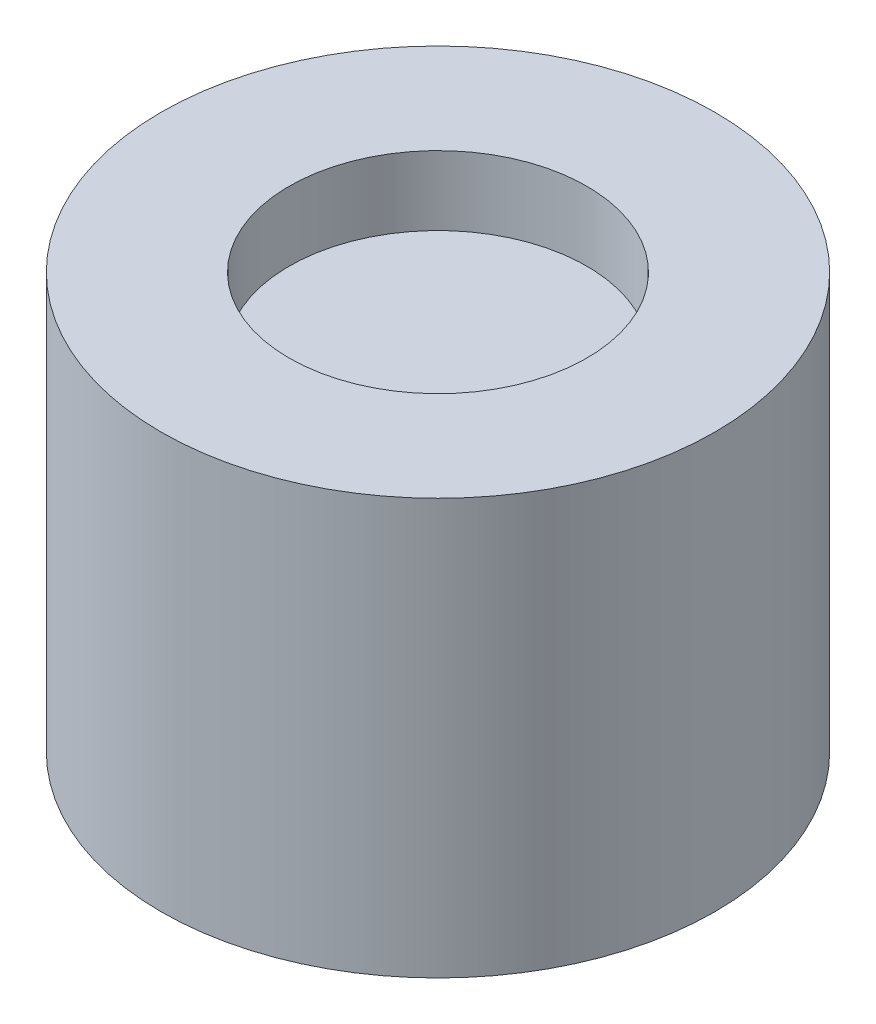
from build123d import *

# Parameters (mm, degrees)
SKETCH1_R        = 4
SKETCH1_R_2      = 1.26
EXTRUSION1_DEPTH = 4
SKETCH2_R        = 4
EXTRUSION2_DEPTH = 1
SKETCH3_R        = 4
SKETCH3_R_2      = 2.15
EXTRUSION3_DEPTH = 1


with BuildPart() as part:
    # Sketch1 → Extrusion1 (new body)
    with BuildSketch(Plane(origin=(0, 0, 0), x_dir=(-1, 0, 0), z_dir=(0, 1, 0))):
        with Locations(Location((0, 0, 0), (0, 0, 90))):
            Circle(SKETCH1_R)
        with Locations(Location((0, 0, 0), (0, 0, 90))):
            Circle(SKETCH1_R_2, mode=Mode.SUBTRACT)
    extrude(amount=EXTRUSION1_DEPTH)

    # Sketch2 → Extrusion2 (add)
    with BuildSketch(Plane(origin=(0, 4, 0), x_dir=(1, 0, 0), z_dir=(0, 1, 0))):
        with Locations(Location((0, 0, 0), (0, 0, 270))):
            Circle(SKETCH2_R)
    extrude(amount=EXTRUSION2_DEPTH)

    # Sketch3 → Extrusion3 (add)
    with BuildSketch(Plane(origin=(0, 5, 0), x_dir=(-1, 0, 0), z_dir=(0, 1, 0))):
        with Locations(Location((0, 0, 0), (0, 0, 90))):
            Circle(SKETCH3_R)
        with Locations(Location((0, 0, 0), (0, 0, 90))):
            Circle(SKETCH3_R_2, mode=Mode.SUBTRACT)
    extrude(amount=EXTRUSION3_DEPTH)


solid = part.part
